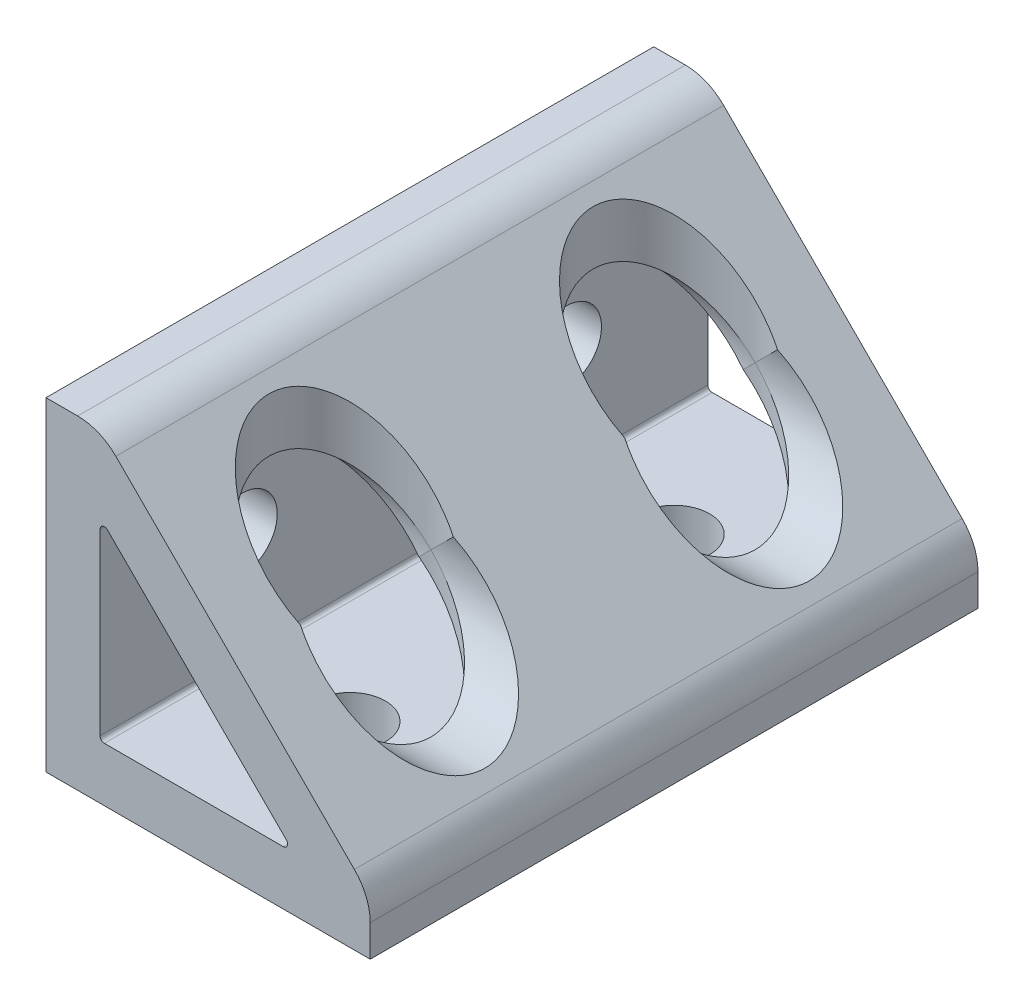
from build123d import *

# Parameters (mm, degrees)
BOSS_EXTRUDE2_DEPTH = 35.7124
CUT_EXTRUDE1_REACH  = 66.642
SKETCH3_R           = 4.1656
CUT_EXTRUDE2_REACH  = 66.642
SKETCH5_R           = 4.1656
SKETCH6_R           = 9.525
CUT_EXTRUDE3_DEPTH  = 47.498
SKETCH7_R           = 9.525
CUT_EXTRUDE4_DEPTH  = 47.498


with BuildPart() as part:
    # Sketch2 → Boss-Extrude2 (new, symmetric)
    with BuildSketch(Plane.XY):
        with BuildLine():
            Line((0, 38.1), (0, 0))
            Line((0, 0), (38.1, 0))
            Line((38.1, 0), (38.1, 3.719743879))
            ThreePointArc((38.1, 3.719743879), (37.616635031, 6.149783674), (36.240128061, 8.209871939))
            Line((36.240128061, 8.209871939), (8.209871939, 36.240128061))
            ThreePointArc((8.209871939, 36.240128061), (6.149783674, 37.616635031), (3.719743879, 38.1))
            Line((3.719743879, 38.1), (0, 38.1))
        make_face()
        with BuildLine():
            Line((6.35, 27.893323389), (6.35, 6.858))
            ThreePointArc((6.35, 6.858), (6.498789755, 6.498789755), (6.858, 6.35))
            Line((6.858, 6.35), (27.893323389, 6.35))
            ThreePointArc((27.893323389, 6.35), (28.362654192, 6.663596816), (28.252533634, 7.217210245))
            Line((28.252533634, 7.217210245), (7.217210245, 28.252533634))
            ThreePointArc((7.217210245, 28.252533634), (6.663596816, 28.362654192), (6.35, 27.893323389))
        make_face(mode=Mode.SUBTRACT)
    extrude(amount=BOSS_EXTRUDE2_DEPTH, both=True)

    # Sketch3 → Cut-Extrude1 (cut, up to next)
    with BuildSketch(Plane.ZY, mode=Mode.PRIVATE) as cut_extrude1_sk1:
        with Locations(Location((19.05, 19.05, 0), (0, 0, 270))):
            Circle(SKETCH3_R)
    cut_extrude1_tool1 = extrude(cut_extrude1_sk1.sketch, amount=-CUT_EXTRUDE1_REACH, mode=Mode.PRIVATE) & part.part
    # Sketch3 → Cut-Extrude1 (cut, up to next)
    with BuildSketch(Plane.ZY, mode=Mode.PRIVATE) as cut_extrude1_sk2:
        with Locations(Location((-19.05, 19.05, 0), (0, 0, 90))):
            Circle(SKETCH3_R)
    cut_extrude1_tool2 = extrude(cut_extrude1_sk2.sketch, amount=-CUT_EXTRUDE1_REACH, mode=Mode.PRIVATE) & part.part
    add(cut_extrude1_tool1.solids().sort_by_distance((0, 19.05, 19.05))[0], mode=Mode.SUBTRACT)
    add(cut_extrude1_tool2.solids().sort_by_distance((0, 19.05, -19.05))[0], mode=Mode.SUBTRACT)

    # Sketch5 → Cut-Extrude2 (cut, up to next)
    with BuildSketch(Plane.XZ, mode=Mode.PRIVATE) as cut_extrude2_sk1:
        with Locations(Location((19.05, 19.05, 0), (0, 0, 270))):
            Circle(SKETCH5_R)
    cut_extrude2_tool1 = extrude(cut_extrude2_sk1.sketch, amount=-CUT_EXTRUDE2_REACH, mode=Mode.PRIVATE) & part.part
    # Sketch5 → Cut-Extrude2 (cut, up to next)
    with BuildSketch(Plane.XZ, mode=Mode.PRIVATE) as cut_extrude2_sk2:
        with Locations(Location((19.05, -19.05, 0), (0, 0, 180))):
            Circle(SKETCH5_R)
    cut_extrude2_tool2 = extrude(cut_extrude2_sk2.sketch, amount=-CUT_EXTRUDE2_REACH, mode=Mode.PRIVATE) & part.part
    add(cut_extrude2_tool1.solids().sort_by_distance((19.05, 0, 19.05))[0], mode=Mode.SUBTRACT)
    add(cut_extrude2_tool2.solids().sort_by_distance((19.05, 0, -19.05))[0], mode=Mode.SUBTRACT)

    # Sketch6 → Cut-Extrude3 (cut)
    with BuildSketch(Plane(origin=(6.35, 0, 0), x_dir=(0, 0, -1), z_dir=(1, 0, 0))):
        with Locations(Location((-19.05, 19.05, 0), (0, 0, 111.808163998))):
            Circle(SKETCH6_R)
        with Locations(Location((19.05, 19.05, 0), (0, 0, 111.808163998))):
            Circle(SKETCH6_R)
    extrude(amount=CUT_EXTRUDE3_DEPTH, mode=Mode.SUBTRACT)

    # Sketch7 → Cut-Extrude4 (cut)
    with BuildSketch(Plane(origin=(0, 6.35, 0), x_dir=(1, 0, 0), z_dir=(0, 1, 0))):
        with Locations((19.05, 19.05)):
            Circle(SKETCH7_R)
        with Locations((19.05, -19.05)):
            Circle(SKETCH7_R)
    extrude(amount=CUT_EXTRUDE4_DEPTH, mode=Mode.SUBTRACT)


solid = part.part
